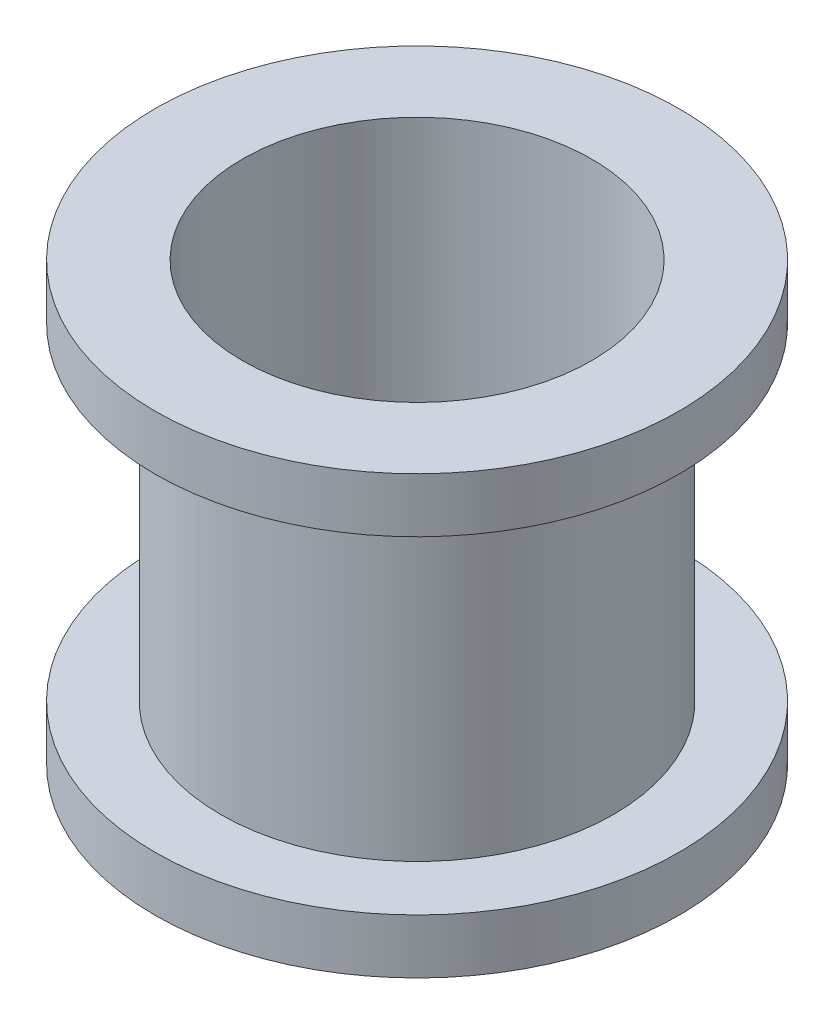
from build123d import *

# Parameters (mm, degrees)
SKETCH1_R           = 18
EXTRUDE1_DEPTH      = 15
SKETCH2_R           = 24
EXTRUDE2_DEPTH      = 5
EXTRUDE4_DEPTH      = 40.395431207
EXTRUDE4_DEPTH_BACK = 40.395431207
SKETCH3_R           = 16


with BuildPart() as part:
    # Sketch1 → Extrude1 (new, symmetric)
    with BuildSketch(Plane(origin=(0, 0, 0), x_dir=(1, 0, 0), z_dir=(0, 1, 0))):
        with Locations(Location((0, 0, 0), (0, 0, 270))):
            Circle(SKETCH1_R)
    extrude(amount=EXTRUDE1_DEPTH, both=True)

    # Sketch2 → Extrude2 (add)
    with BuildSketch(Plane(origin=(0, 15, 0), x_dir=(1, 0, 0), z_dir=(0, 1, 0))):
        with Locations(Location((0, 0, 0), (0, 0, 270))):
            Circle(SKETCH2_R)
    extrude2 = extrude(amount=EXTRUDE2_DEPTH)

    # Mirror1: Extrude2 across plane
    add(extrude2.mirror(Plane.ZX))

    # Sketch3 → Extrude4 (cut, two sides: drawn at the far end of the back side and taken through both)
    with BuildSketch(Plane(origin=(0, 0, 0), x_dir=(1, 0, 0), z_dir=(0, 1, 0)).offset(-EXTRUDE4_DEPTH_BACK)):
        with Locations(Location((0, 0, 0), (0, 0, 270))):
            Circle(SKETCH3_R)
    extrude(amount=EXTRUDE4_DEPTH + EXTRUDE4_DEPTH_BACK, mode=Mode.SUBTRACT)


solid = part.part
